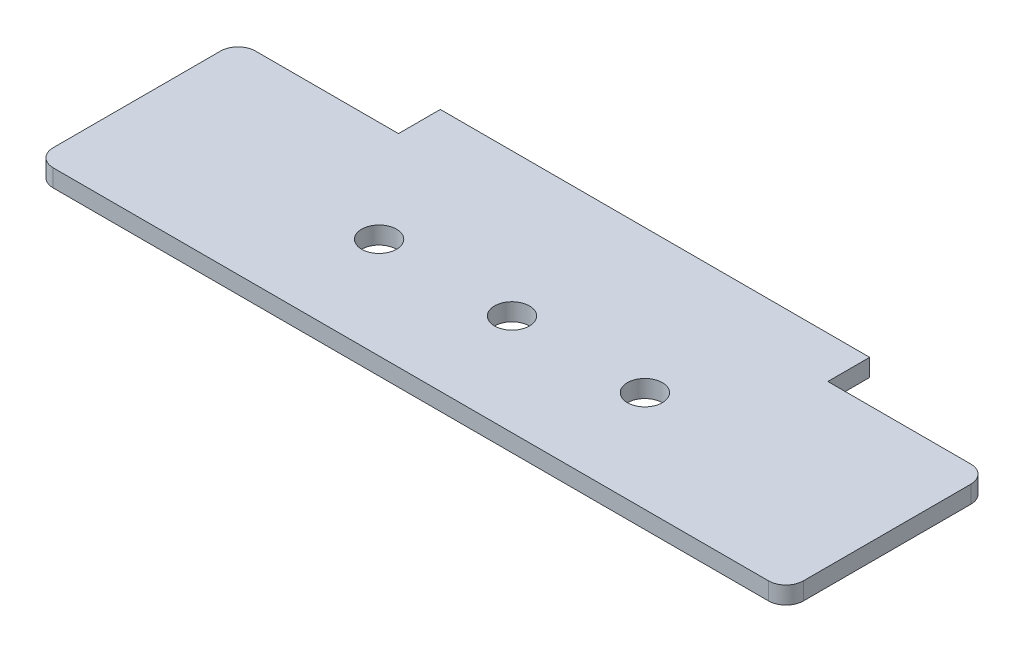
from build123d import *

# Parameters (mm, degrees)
SKETCH1_R           = 0.5
BOSS_EXTRUDE1_DEPTH = 0.5


with BuildPart() as part:
    # Sketch1 → Boss-Extrude1 (new body)
    with BuildSketch(Plane(origin=(0, 0, 0), x_dir=(1, 0, 0), z_dir=(0, 1, 0))):
        with BuildLine():
            Line((9.965, 2.9), (14.065, 2.9))
            ThreePointArc((14.065, 2.9), (14.418553391, 2.753553391), (14.565, 2.4))
            Line((14.565, 2.4), (14.565, -2.4))
            ThreePointArc((14.565, -2.4), (14.418553391, -2.753553391), (14.065, -2.9))
            Line((14.065, -2.9), (-6.445, -2.9))
            ThreePointArc((-6.445, -2.9), (-6.798553391, -2.753553391), (-6.945, -2.4))
            Line((-6.945, -2.4), (-6.945, 2.4))
            ThreePointArc((-6.945, 2.4), (-6.798553391, 2.753553391), (-6.445, 2.9))
            Line((-6.445, 2.9), (-2.345, 2.9))
            Line((-2.345, 2.9), (-2.345, 4.1))
            Line((-2.345, 4.1), (9.965, 4.1))
            Line((9.965, 4.1), (9.965, 2.9))
        make_face()
        with Locations(Location((0, 0, 0), (0, 0, 270))):
            Circle(SKETCH1_R, mode=Mode.SUBTRACT)
        with Locations(Location((3.81, 0, 0), (0, 0, 270))):
            Circle(SKETCH1_R, mode=Mode.SUBTRACT)
        with Locations(Location((7.62, 0, 0), (0, 0, 270))):
            Circle(SKETCH1_R, mode=Mode.SUBTRACT)
    extrude(amount=BOSS_EXTRUDE1_DEPTH)


solid = part.part
